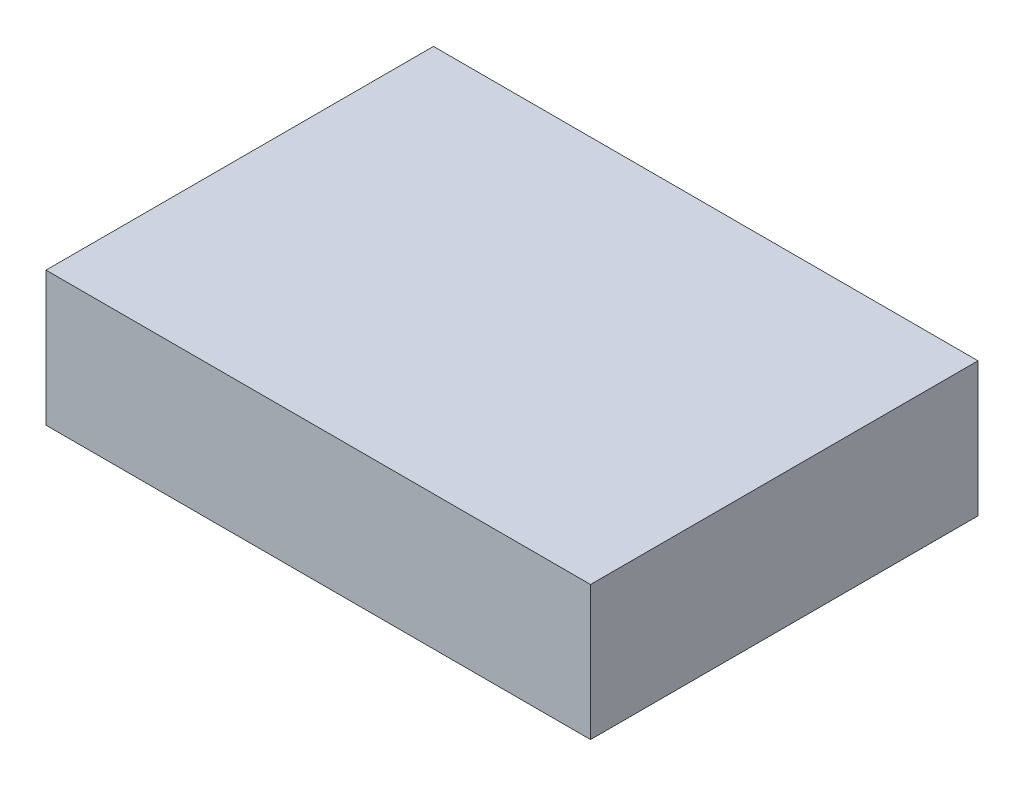
from build123d import *

# Parameters (mm, degrees)
ESQUISSE1_W        = 52.7
ESQUISSE1_H        = 37.5
BOSS_EXTRU_1_DEPTH = 13


with BuildPart() as part:
    # Esquisse1 → Boss.-Extru.1 (new body)
    with BuildSketch(Plane(origin=(0, 0, 0), x_dir=(1, 0, 0), z_dir=(0, 1, 0))):
        Rectangle(ESQUISSE1_W, ESQUISSE1_H)
    extrude(amount=BOSS_EXTRU_1_DEPTH)


solid = part.part
